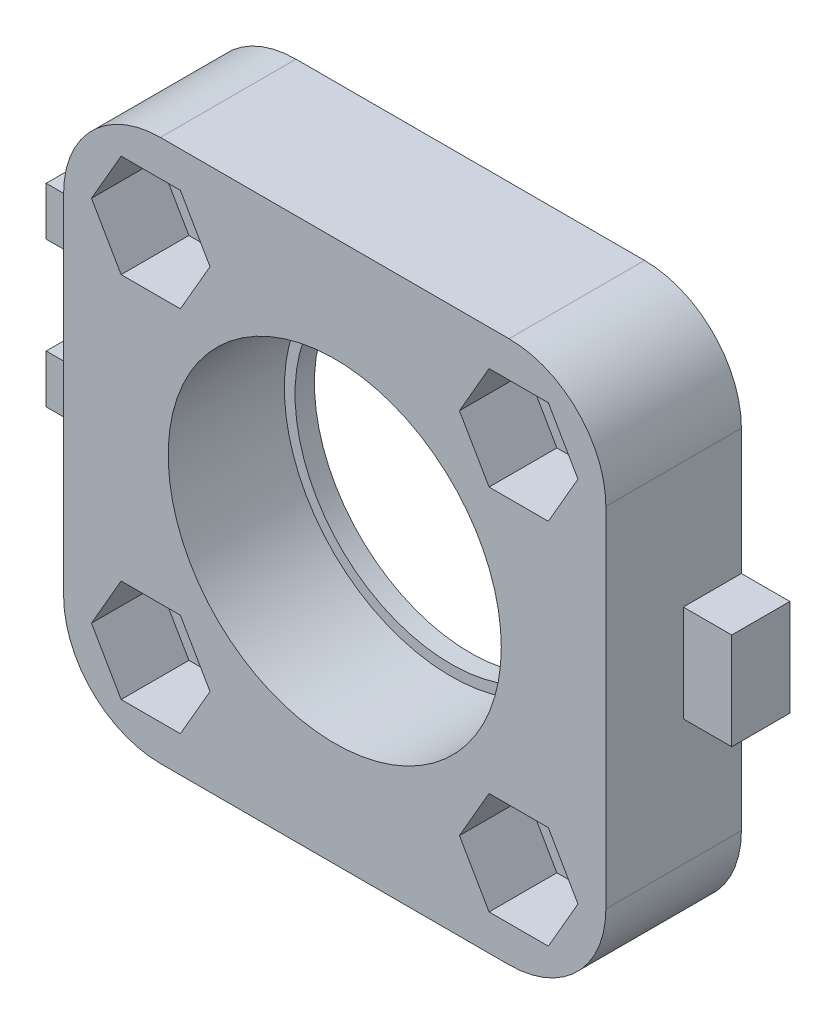
from build123d import *

# Parameters (mm, degrees)
CROQUIS1_W              = 28
CROQUIS1_H              = 28
CROQUIS1_R              = 8.05
SALIENTE_EXTRUIR1_DEPTH = 0.5
CROQUIS2_W              = 28
CROQUIS2_H              = 28
CROQUIS2_R              = 8.6
SALIENTE_EXTRUIR2_DEPTH = 6
CORTAR_EXTRUIR1_DEPTH   = 3.5
CROQUIS6_R              = 1.5
CORTAR_EXTRUIR2_DEPTH   = 23.5
CROQUIS7_W              = 2.5
CROQUIS7_H              = 5
CROQUIS7_W_2            = 10
CROQUIS7_H_2            = 4
SALIENTE_EXTRUIR3_DEPTH = 3
REDONDEO1_R             = 5


with BuildPart() as part:
    # Croquis1 → Saliente-Extruir1 (new, symmetric)
    with BuildSketch(Plane.XY):
        Rectangle(CROQUIS1_W, CROQUIS1_H)
        Circle(CROQUIS1_R, mode=Mode.SUBTRACT)
    extrude(amount=SALIENTE_EXTRUIR1_DEPTH, both=True)

    # Croquis2 → Saliente-Extruir2 (add)
    with BuildSketch(Plane.XY.offset(0.5)):
        Rectangle(CROQUIS2_W, CROQUIS2_H)
        Circle(CROQUIS2_R, mode=Mode.SUBTRACT)
    extrude(amount=SALIENTE_EXTRUIR2_DEPTH)

    # Croquis3 → Cortar-Extruir1 (cut)
    with BuildSketch(Plane.XY.offset(6.5)):
        Polygon((11.029978213, 12.15), (7.970021787, 12.15), (6.440043573, 9.5), (7.970021787, 6.85), (11.029978213, 6.85), (12.559956427, 9.5), align=None)
        Polygon((-6.440043573, 9.5), (-7.970021787, 12.15), (-11.029978213, 12.15), (-12.559956427, 9.5), (-11.029978213, 6.85), (-7.970021787, 6.85), align=None)
        Polygon((-7.970021787, -6.85), (-11.029978213, -6.85), (-12.559956427, -9.5), (-11.029978213, -12.15), (-7.970021787, -12.15), (-6.440043573, -9.5), align=None)
        Polygon((11.029978213, -6.85), (7.970021787, -6.85), (6.440043573, -9.5), (7.970021787, -12.15), (11.029978213, -12.15), (12.559956427, -9.5), align=None)
    extrude(amount=-CORTAR_EXTRUIR1_DEPTH, mode=Mode.SUBTRACT)

    # Croquis6 → Cortar-Extruir2 (cut)
    with BuildSketch(Plane(origin=(0, 0, -0.5), x_dir=(-1, 0, 0), z_dir=(0, 0, -1))):
        with Locations((-9.5, 9.5)):
            Circle(CROQUIS6_R)
        with Locations((9.5, 9.5)):
            Circle(CROQUIS6_R)
        with Locations((9.5, -9.5)):
            Circle(CROQUIS6_R)
        with Locations((-9.5, -9.5)):
            Circle(CROQUIS6_R)
    extrude(amount=-CORTAR_EXTRUIR2_DEPTH, mode=Mode.SUBTRACT)

    # Croquis7 → Saliente-Extruir3 (add)
    with BuildSketch(Plane(origin=(0, 0, -0.5), x_dir=(-1, 0, 0), z_dir=(0, 0, -1))):
        with Locations((-15.25, 0)):
            Rectangle(CROQUIS7_W, CROQUIS7_H)
        with Locations((0, -16)):
            Rectangle(CROQUIS7_W_2, CROQUIS7_H_2)
        Polygon((14, -2.5), (14, -5), (18.9, -5), (18.9, -2.5), (16.5, -2.5), align=None)
        with Locations((15.25, 0)):
            Rectangle(CROQUIS7_W, CROQUIS7_H)
        Polygon((14, 5), (14, 2.5), (16.5, 2.5), (18.9, 2.5), (18.9, 5), align=None)
    extrude(amount=-SALIENTE_EXTRUIR3_DEPTH)

    # Redondeo1
    redondeo1_edges = [part.edges().sort_by_distance(p)[0] for p in [
        (14, -14, 3),
        (-14, -14, 3),
        (-14, 14, 3),
        (14, 14, 3),
    ]]
    fillet(redondeo1_edges, radius=REDONDEO1_R)


solid = part.part
